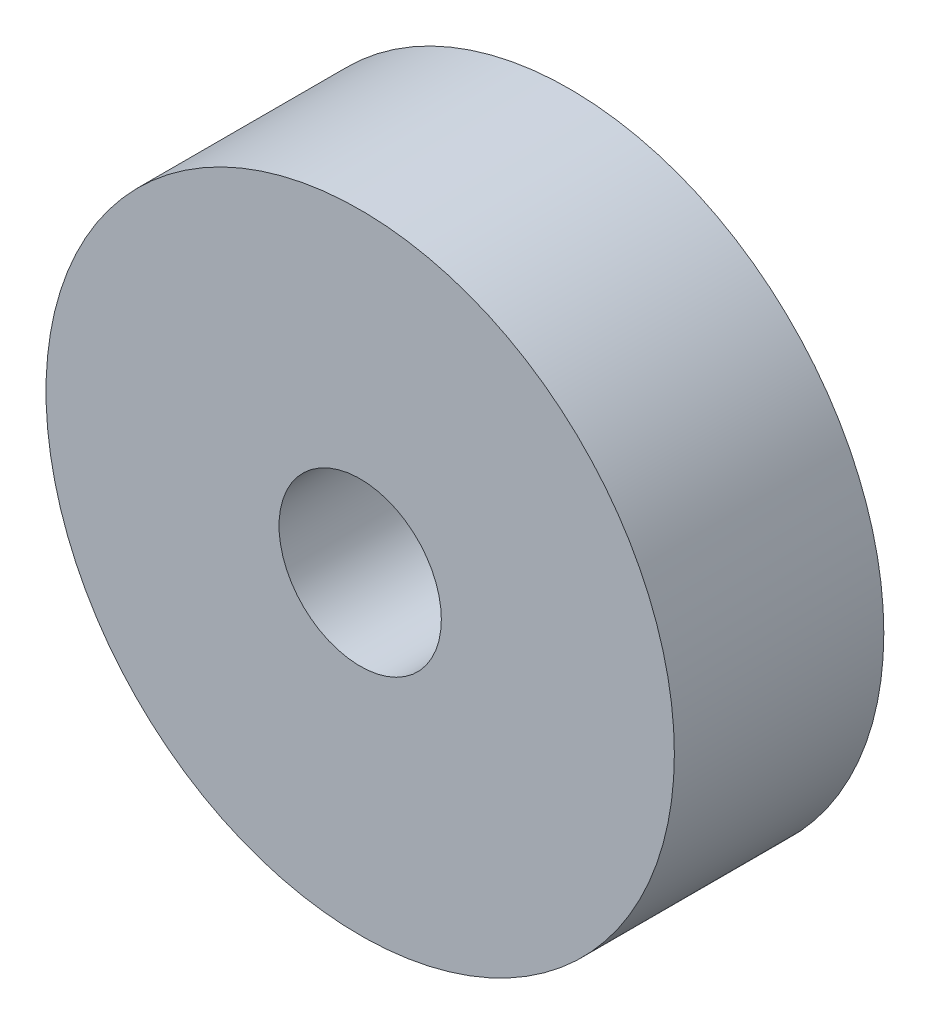
from build123d import *

# Parameters (mm, degrees)
SKETCH_1_R      = 6
SKETCH_1_R_2    = 1.55
EXTRUDE_1_DEPTH = 4


with BuildPart() as part:
    # 草图1 → 凸台-拉伸1 (new body)
    with BuildSketch(Plane.XY):
        Circle(SKETCH_1_R)
        Circle(SKETCH_1_R_2, mode=Mode.SUBTRACT)
    extrude(amount=EXTRUDE_1_DEPTH)


solid = part.part
